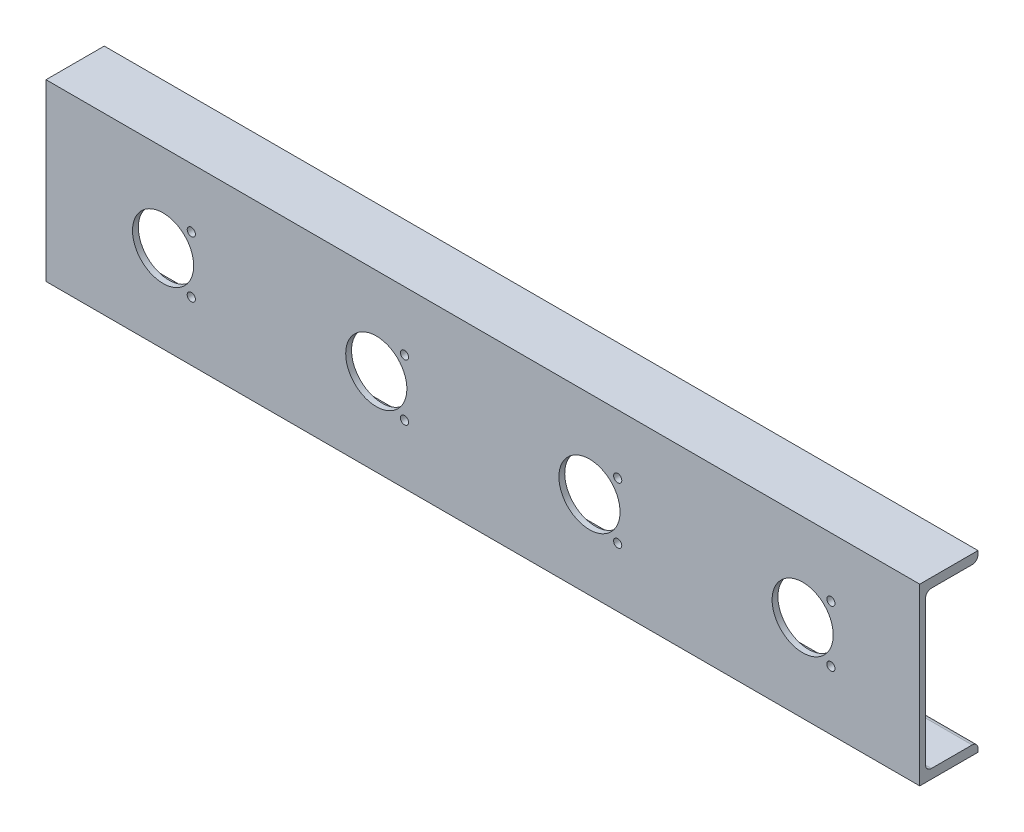
from build123d import *

# Parameters (mm, degrees)
BOSS_EXTRUDE1_DEPTH = 1500
SKETCH5_R           = 52.5
CUT_EXTRUDE3_DEPTH  = 30
LPATTERN2_COUNT     = 4
LPATTERN2_PITCH     = 366
SKETCH6_R           = 7
CUT_EXTRUDE4_DEPTH  = 1515.807183702
LPATTERN3_COUNT     = 4
LPATTERN3_PITCH     = 366


with BuildPart() as part:
    # Sketch1 → Boss-Extrude1 (new body)
    with BuildSketch(Plane(origin=(0, 0, 0), x_dir=(0, 0, -1), z_dir=(1, 0, 0))):
        with BuildLine():
            Line((-86.622073579, 113.879598662), (-186.622073579, 113.879598662))
            Line((-186.622073579, 113.879598662), (-186.622073579, -186.120401338))
            Line((-186.622073579, -186.120401338), (-86.622073579, -186.120401338))
            Line((-86.622073579, -186.120401338), (-86.622073579, -180.120401338))
            ThreePointArc((-86.622073579, -180.120401338), (-89.551005767, -173.049333526), (-96.622073579, -170.120401338))
            Line((-96.622073579, -170.120401338), (-166.622073579, -170.120401338))
            ThreePointArc((-166.622073579, -170.120401338), (-173.69314139, -167.19146915), (-176.622073579, -160.120401338))
            Line((-176.622073579, -160.120401338), (-176.622073579, 87.879598662))
            ThreePointArc((-176.622073579, 87.879598662), (-173.69314139, 94.950666474), (-166.622073579, 97.879598662))
            Line((-166.622073579, 97.879598662), (-96.622073579, 97.879598662))
            ThreePointArc((-96.622073579, 97.879598662), (-89.551005767, 100.80853085), (-86.622073579, 107.879598662))
            Line((-86.622073579, 107.879598662), (-86.622073579, 113.879598662))
        make_face()
    extrude(amount=BOSS_EXTRUDE1_DEPTH)

    # Sketch5 → Cut-Extrude3 (cut)
    with BuildSketch(Plane(origin=(0, 0, 176.622073579), x_dir=(-1, 0, 0), z_dir=(0, 0, -1))):
        with Locations(Location((-1299, -36.120401338, 0), (0, 0, 90))):
            Circle(SKETCH5_R)
    cut_extrude3 = extrude(amount=-CUT_EXTRUDE3_DEPTH, mode=Mode.SUBTRACT)

    # LPattern2: Cut-Extrude3 ×4
    with Locations(*[(-i * LPATTERN2_PITCH, 0, 0) for i in range(1, LPATTERN2_COUNT)]):
        add(cut_extrude3, mode=Mode.SUBTRACT)

    # Sketch6 → Cut-Extrude4 (cut, symmetric)
    with BuildSketch(Plane.XY.offset(186.622073579)):
        with Locations(Location((1347.436814511, 12.316413173, 0), (0, 0, 270))):
            Circle(SKETCH6_R)
        with Locations(Location((1347.436814511, -84.557215849, 0), (0, 0, 270))):
            Circle(SKETCH6_R)
    cut_extrude4 = extrude(amount=CUT_EXTRUDE4_DEPTH, both=True, mode=Mode.SUBTRACT)

    # LPattern3: Cut-Extrude4 ×4
    with Locations(*[(-i * LPATTERN3_PITCH, 0, 0) for i in range(1, LPATTERN3_COUNT)]):
        add(cut_extrude4, mode=Mode.SUBTRACT)


solid = part.part
